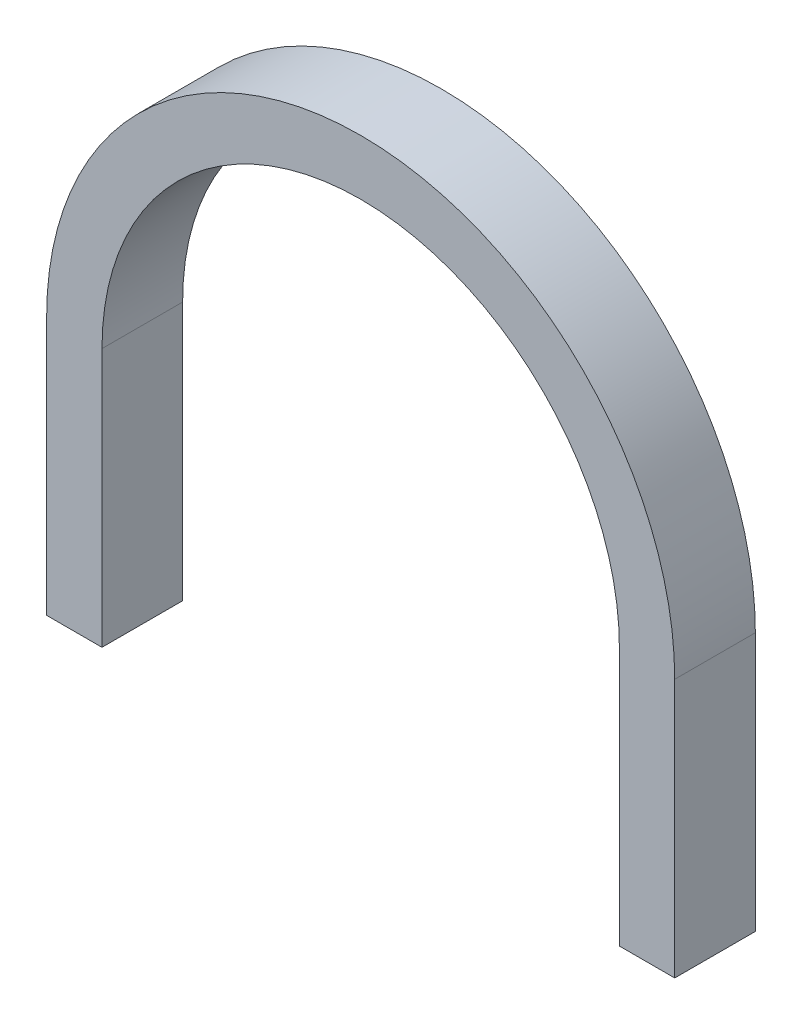
from build123d import *

# Parameters (mm, degrees)
BOSS_EXTRUDE1_DEPTH = 3.8


with BuildPart() as part:
    # Sketch1 → Boss-Extrude1 (new body)
    with BuildSketch(Plane.XY):
        with BuildLine():
            Line((-12.192, -12.192), (-14.8, -12.192))
            Line((-14.8, -12.192), (-14.8, 0))
            ThreePointArc((-14.8, 0), (0, 14.8), (14.8, 0))
            Line((14.8, 0), (14.8, -12.192))
            Line((14.8, -12.192), (12.192, -12.192))
            Line((12.192, -12.192), (12.192, 0))
            ThreePointArc((12.192, 0), (0, 12.192), (-12.192, 0))
            Line((-12.192, 0), (-12.192, -12.192))
        make_face()
    extrude(amount=BOSS_EXTRUDE1_DEPTH)


solid = part.part
